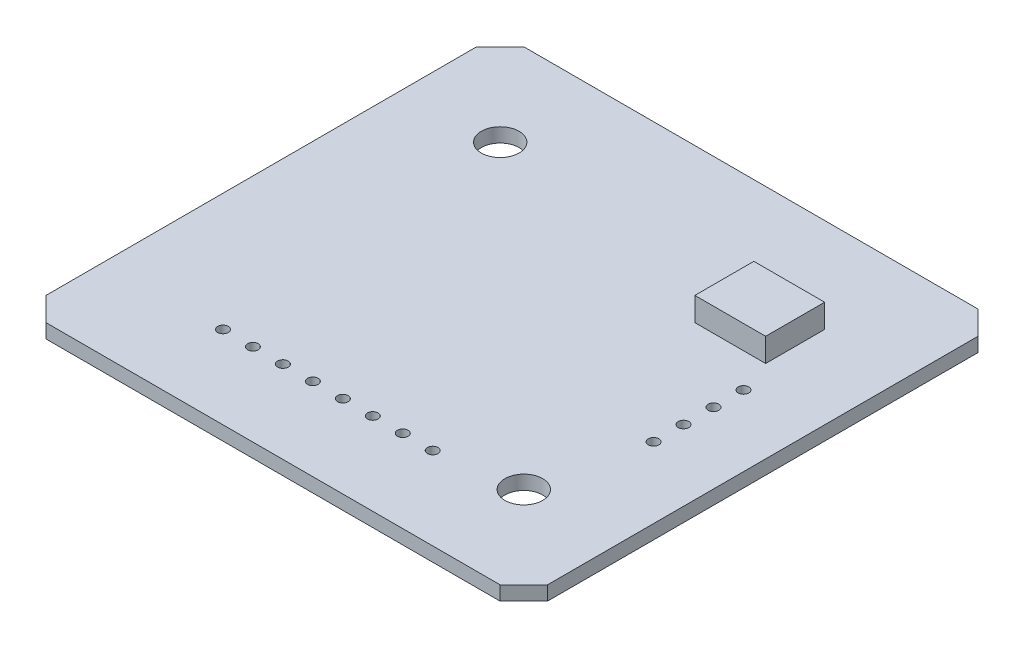
from build123d import *

# Parameters (mm, degrees)
SKETCH_1_R      = 1.6
SKETCH_1_R_2    = 0.45
EXTRUDE_1_DEPTH = 1.2
SKETCH_3_W      = 6
SKETCH_3_H      = 5
EXTRUDE_2_DEPTH = 2


with BuildPart() as part:
    # 草图1 → 凸台-拉伸1 (new body)
    with BuildSketch(Plane(origin=(0, 0, 0), x_dir=(1, 0, 0), z_dir=(0, 1, 0))):
        Polygon((19.25, -20.25), (21.25, -18.25), (21.25, 18.25), (19.25, 20.25), (-19.25, 20.25), (-21.25, 18.25), (-21.25, -18.25), (-19.25, -20.25), align=None)
        with Locations(Location((13.25, -12.25, 0), (0, 0, 270))):
            Circle(SKETCH_1_R, mode=Mode.SUBTRACT)
        with Locations(Location((-13.25, 12.25, 0), (0, 0, 270))):
            Circle(SKETCH_1_R, mode=Mode.SUBTRACT)
        with Locations(Location((-11.25, -13.25, 0), (0, 0, 270))):
            Circle(SKETCH_1_R_2, mode=Mode.SUBTRACT)
        with Locations(Location((-8.71, -13.25, 0), (0, 0, 270))):
            Circle(SKETCH_1_R_2, mode=Mode.SUBTRACT)
        with Locations(Location((-6.17, -13.25, 0), (0, 0, 270))):
            Circle(SKETCH_1_R_2, mode=Mode.SUBTRACT)
        with Locations(Location((-3.63, -13.25, 0), (0, 0, 270))):
            Circle(SKETCH_1_R_2, mode=Mode.SUBTRACT)
        with Locations(Location((-1.09, -13.25, 0), (0, 0, 270))):
            Circle(SKETCH_1_R_2, mode=Mode.SUBTRACT)
        with Locations(Location((1.45, -13.25, 0), (0, 0, 270))):
            Circle(SKETCH_1_R_2, mode=Mode.SUBTRACT)
        with Locations(Location((3.99, -13.25, 0), (0, 0, 270))):
            Circle(SKETCH_1_R_2, mode=Mode.SUBTRACT)
        with Locations(Location((6.53, -13.25, 0), (0, 0, 270))):
            Circle(SKETCH_1_R_2, mode=Mode.SUBTRACT)
        with Locations(Location((15.25, -3.25, 0), (0, 0, 270))):
            Circle(SKETCH_1_R_2, mode=Mode.SUBTRACT)
        with Locations(Location((15.25, -0.71, 0), (0, 0, 270))):
            Circle(SKETCH_1_R_2, mode=Mode.SUBTRACT)
        with Locations(Location((15.25, 1.83, 0), (0, 0, 270))):
            Circle(SKETCH_1_R_2, mode=Mode.SUBTRACT)
        with Locations(Location((15.25, 4.37, 0), (0, 0, 270))):
            Circle(SKETCH_1_R_2, mode=Mode.SUBTRACT)
    extrude(amount=EXTRUDE_1_DEPTH)

    # 草图3 → 凸台-拉伸2 (add)
    with BuildSketch(Plane(origin=(0, 1.2, 0), x_dir=(1, 0, 0), z_dir=(0, 1, 0))):
        with Locations((11.25, 9.75)):
            Rectangle(SKETCH_3_W, SKETCH_3_H)
    extrude(amount=EXTRUDE_2_DEPTH)


solid = part.part
